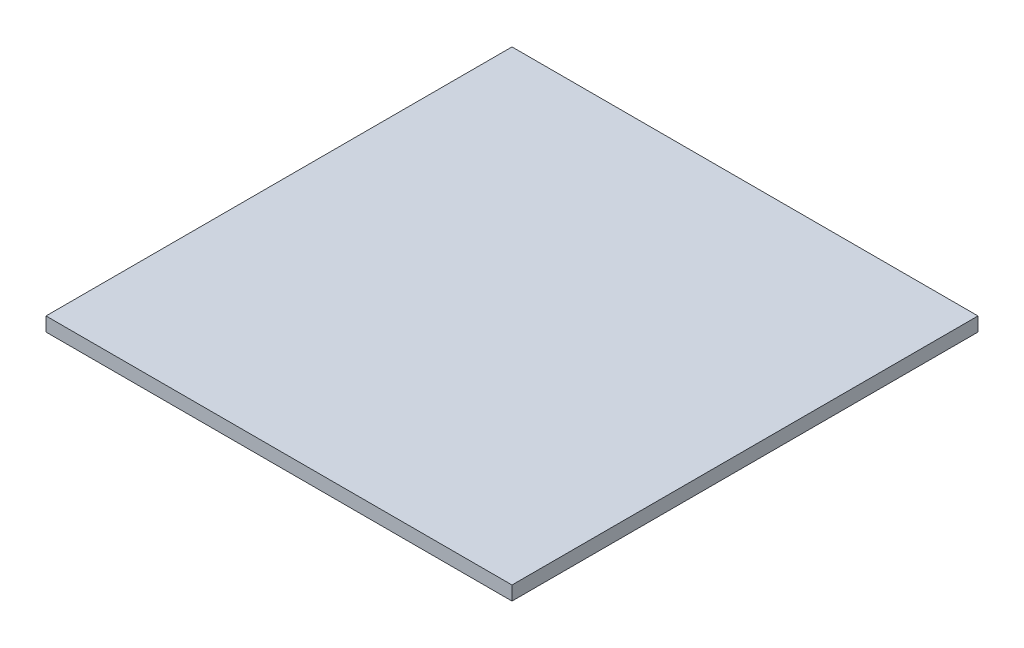
from build123d import *

# Parameters (mm, degrees)
SKETCH2_W           = 50.8
SKETCH2_H           = 50.8
BOSS_EXTRUDE1_DEPTH = 1.524


with BuildPart() as part:
    # Sketch2 → Boss-Extrude1 (new body)
    with BuildSketch(Plane(origin=(0, 0, 0), x_dir=(1, 0, 0), z_dir=(0, 1, 0))):
        Rectangle(SKETCH2_W, SKETCH2_H)
    extrude(amount=BOSS_EXTRUDE1_DEPTH)


solid = part.part
